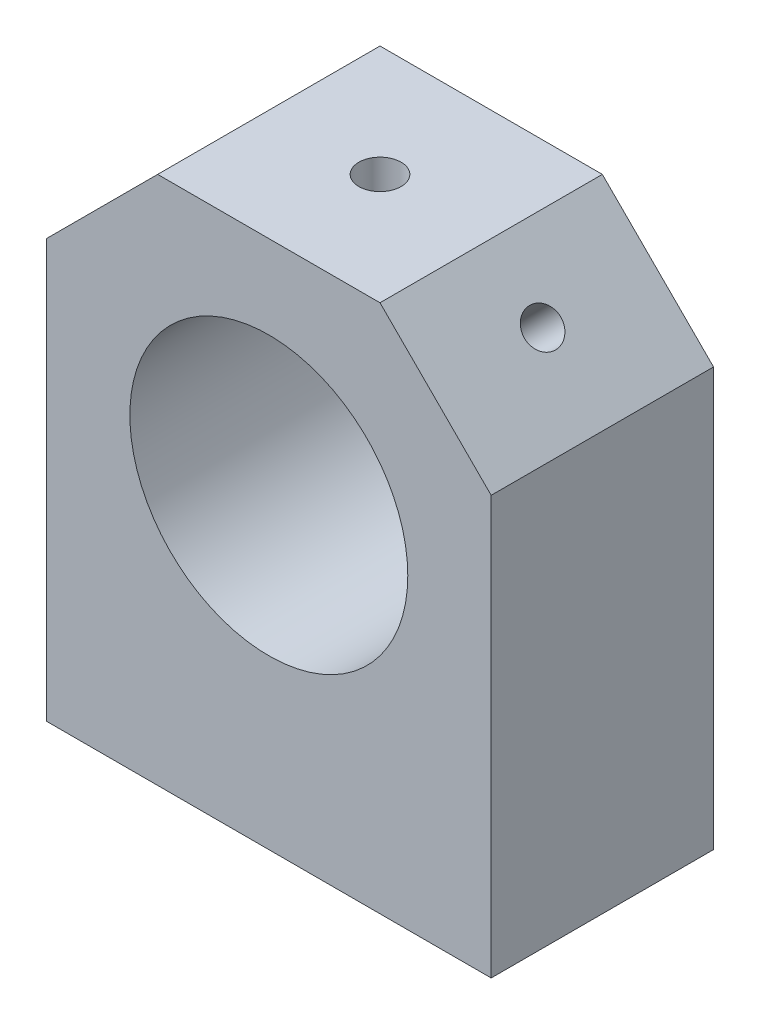
from build123d import *

# Parameters (mm, degrees)
SKETCH2_R                   = 15.875
BOSS_EXTRUDE1_DEPTH         = 25.4
F_1_2_20_TAPPED_HOLE1_D     = 4.826
F_1_2_20_TAPPED_HOLE1_DEPTH = 31.75
F_1_2_20_TAPPED_HOLE1_TIP   = 1.449876674
F_1_2_20_TAPPED_HOLE2_D     = 4.1656
F_1_2_20_TAPPED_HOLE2_DEPTH = 31.75
F_1_2_20_TAPPED_HOLE2_TIP   = 1.251472497
F_1_2_20_TAPPED_HOLE3_D     = 4.1656
F_1_2_20_TAPPED_HOLE3_DEPTH = 31.75
F_1_2_20_TAPPED_HOLE3_TIP   = 1.251472497


with BuildPart() as part:
    # Sketch2 → Boss-Extrude1 (new body)
    with BuildSketch(Plane.XY):
        Polygon((-38.1, 60.452), (-50.8, 47.752), (-50.8, 0), (0, 0), (0, 47.752), (-12.7, 60.452), align=None)
        with Locations((-25.4, 35.052)):
            Circle(SKETCH2_R, mode=Mode.SUBTRACT)
    extrude(amount=BOSS_EXTRUDE1_DEPTH)

    # 1/2-20 Tapped Hole1
    with Locations(Plane(origin=(-25.4, 60.452, 12.7), x_dir=(1, 0, 0), z_dir=(0, 1, 0))):
        with Locations((0, 0)):
            Hole(F_1_2_20_TAPPED_HOLE1_D / 2, depth=F_1_2_20_TAPPED_HOLE1_DEPTH)
            with Locations((0, 0, -(F_1_2_20_TAPPED_HOLE1_DEPTH + F_1_2_20_TAPPED_HOLE1_TIP / 2))):  # 118° drill point
                Cone(0, F_1_2_20_TAPPED_HOLE1_D / 2, F_1_2_20_TAPPED_HOLE1_TIP, mode=Mode.SUBTRACT)

    # 1/2-20 Tapped Hole2
    with Locations(Plane(origin=(-44.924994652, 53.627005348, 12.7), x_dir=(-0.707106781187, -0.707106781187, 0), z_dir=(-0.707106781187, 0.707106781187, 0))):
        with Locations((0, 0)):
            Hole(F_1_2_20_TAPPED_HOLE2_D / 2, depth=F_1_2_20_TAPPED_HOLE2_DEPTH)
            with Locations((0, 0, -(F_1_2_20_TAPPED_HOLE2_DEPTH + F_1_2_20_TAPPED_HOLE2_TIP / 2))):  # 118° drill point
                Cone(0, F_1_2_20_TAPPED_HOLE2_D / 2, F_1_2_20_TAPPED_HOLE2_TIP, mode=Mode.SUBTRACT)

    # 1/2-20 Tapped Hole3
    with Locations(Plane(origin=(-6.824994652, 54.576994652, 12.7), x_dir=(0.707106781187, -0.707106781187, 0), z_dir=(0.707106781187, 0.707106781187, 0))):
        with Locations((0, 0)):
            Hole(F_1_2_20_TAPPED_HOLE3_D / 2, depth=F_1_2_20_TAPPED_HOLE3_DEPTH)
            with Locations((0, 0, -(F_1_2_20_TAPPED_HOLE3_DEPTH + F_1_2_20_TAPPED_HOLE3_TIP / 2))):  # 118° drill point
                Cone(0, F_1_2_20_TAPPED_HOLE3_D / 2, F_1_2_20_TAPPED_HOLE3_TIP, mode=Mode.SUBTRACT)


solid = part.part
